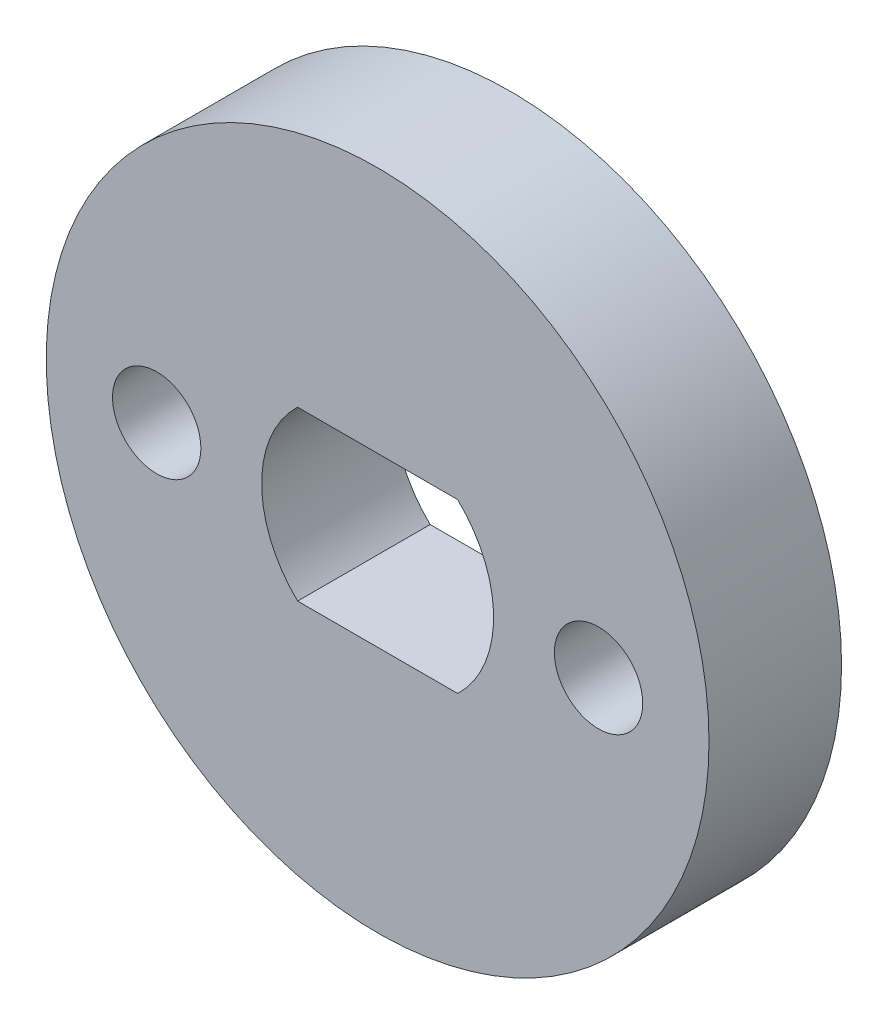
from build123d import *

# Parameters (mm, degrees)
SKETCH1_R             = 7.5
BOSS_EXTRUDE1_DEPTH   = 3
CUT_EXTRUDE1_DEPTH    = 3
SKETCH6_W             = 1.811249569
SKETCH6_H             = 3.8
CUT_EXTRUDE2_DEPTH    = 3
F_2_0MM_DOWEL_HOLE1_D = 2


with BuildPart() as part:
    # Sketch1 → Boss-Extrude1 (new body)
    with BuildSketch(Plane.XY):
        Circle(SKETCH1_R)
    extrude(amount=BOSS_EXTRUDE1_DEPTH)

    # Sketch5 → Cut-Extrude1 (cut)
    with BuildSketch(Plane.XY.offset(3)):
        with BuildLine():
            Line((-1.811249569, 1.9), (-1.811249569, -1.9))
            ThreePointArc((-1.811249569, -1.9), (-2.625, 0), (-1.811249569, 1.9))
        make_face()
    cut_extrude1 = extrude(amount=-CUT_EXTRUDE1_DEPTH, mode=Mode.SUBTRACT)

    # Sketch6 → Cut-Extrude2 (cut)
    with BuildSketch(Plane.XY.offset(3)):
        with Locations((-0.905624785, 0)):
            Rectangle(SKETCH6_W, SKETCH6_H)
    cut_extrude2 = extrude(amount=-CUT_EXTRUDE2_DEPTH, mode=Mode.SUBTRACT)

    # Mirror1: Cut-Extrude1, Cut-Extrude2 across plane
    add(cut_extrude1.mirror(Plane(origin=(0, 0, 0), x_dir=(0, 0, 1), z_dir=(1, 0, 0))), mode=Mode.SUBTRACT)
    add(cut_extrude2.mirror(Plane(origin=(0, 0, 0), x_dir=(0, 0, 1), z_dir=(1, 0, 0))), mode=Mode.SUBTRACT)

    # Ø2.0mm Dowel Hole1 (through all)
    with Locations(Plane.XY.offset(3)):
        with Locations((5, 0), (-5, 0)):
            Hole(F_2_0MM_DOWEL_HOLE1_D / 2)


solid = part.part
